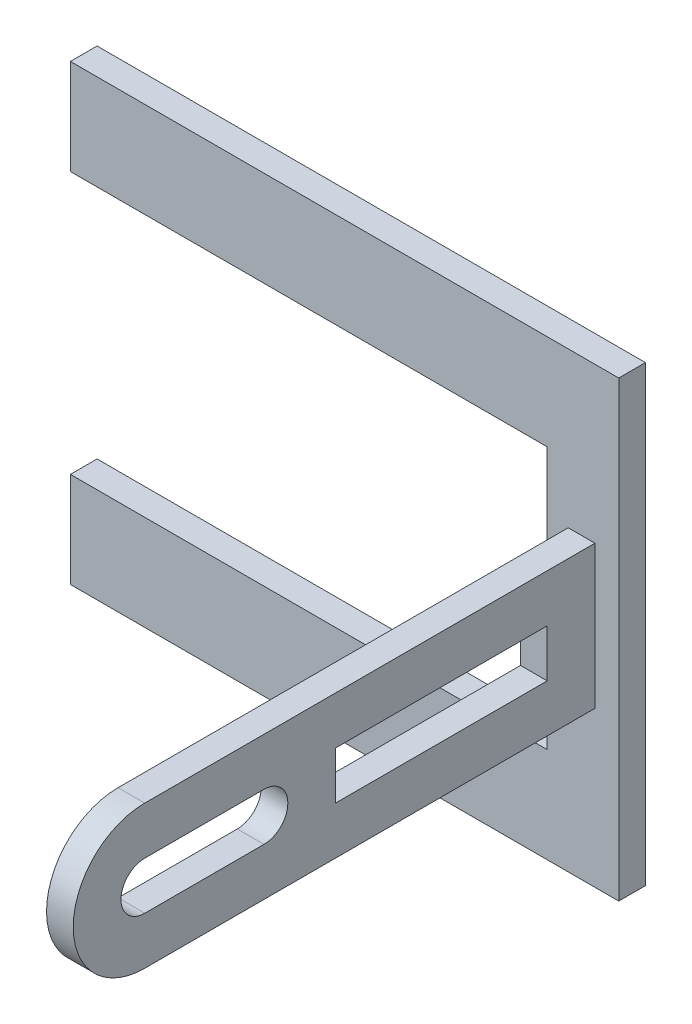
from build123d import *

# Parameters (mm, degrees)
BOSS_EXTRUDE1_DEPTH = 2.8
SKETCH2_W           = 22.2
SKETCH2_H           = 5
BOSS_EXTRUDE2_DEPTH = 2.8


with BuildPart() as part:
    # Sketch1 → Boss-Extrude1 (new body)
    with BuildSketch(Plane.XY):
        Polygon((-25, -13.75), (25, -13.75), (25, 13.75), (-25, 13.75), (-25, 23.75), (32.5, 23.75), (32.5, -23.75), (-25, -23.75), align=None)
    extrude(amount=BOSS_EXTRUDE1_DEPTH)

    # Sketch2 → Boss-Extrude2 (add)
    with BuildSketch(Plane(origin=(30, 0, 0), x_dir=(0, 0, -1), z_dir=(1, 0, 0))):
        with BuildLine():
            Line((-2.8, -7.5), (-2.8, 7.5))
            Line((-2.8, 7.5), (-50, 7.5))
            ThreePointArc((-50, 7.5), (-57.5, 0), (-50, -7.5))
            Line((-50, -7.5), (-2.8, -7.5))
        make_face()
        with BuildLine():
            Line((-50, -2.5), (-37.5, -2.5))
            ThreePointArc((-37.5, -2.5), (-35, 0), (-37.5, 2.5))
            Line((-37.5, 2.5), (-50, 2.5))
            ThreePointArc((-50, 2.5), (-52.5, 0), (-50, -2.5))
        make_face(mode=Mode.SUBTRACT)
        with Locations((-18.9, 0)):
            Rectangle(SKETCH2_W, SKETCH2_H, mode=Mode.SUBTRACT)
    extrude(amount=-BOSS_EXTRUDE2_DEPTH)


solid = part.part
